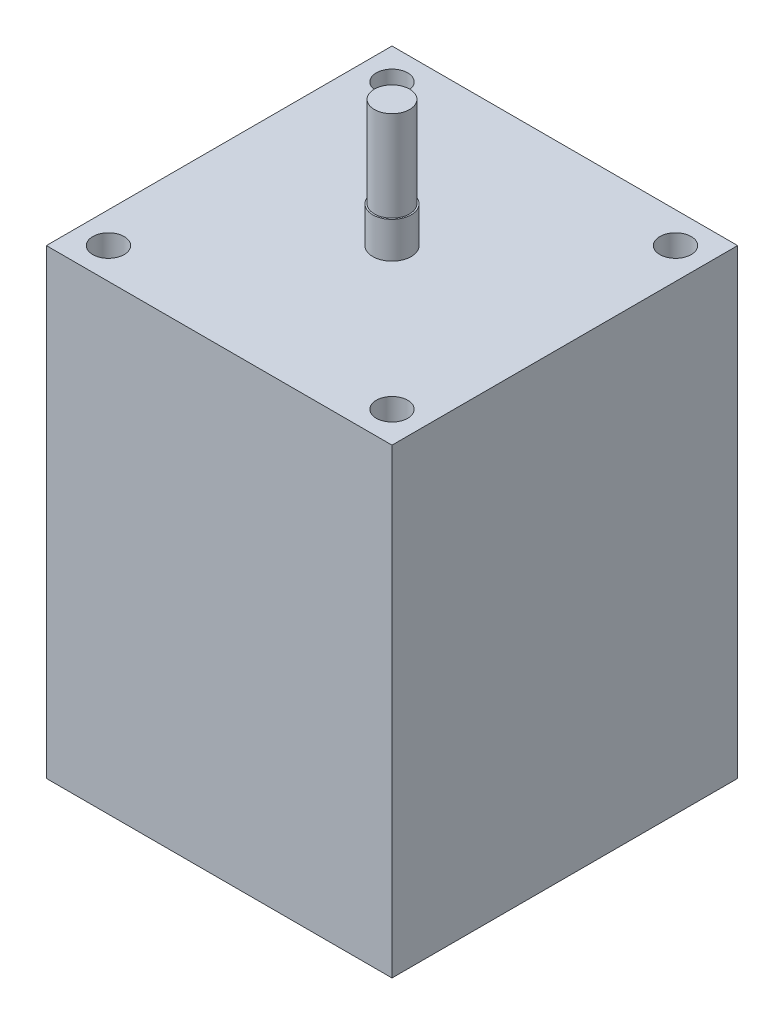
from build123d import *

# Parameters (mm, degrees)
SKETCH1_W           = 57.3
SKETCH1_H           = 57.3
SKETCH1_R           = 2.6
SKETCH1_R_2         = 3.175
BOSS_EXTRUDE1_DEPTH = 76.5
SKETCH1_4_R         = 3.175
SKETCH1_4_R_2       = 2.925
BOSS_EXTRUDE2_DEPTH = 82.5
SKETCH1_5_R         = 2.925
BOSS_EXTRUDE3_DEPTH = 97.5


with BuildPart() as part:
    # Sketch1 → Boss-Extrude1 (new body)
    with BuildSketch(Plane(origin=(0, 0, 0), x_dir=(1, 0, 0), z_dir=(0, 1, 0))):
        with Locations((28.65, -28.65)):
            Rectangle(SKETCH1_W, SKETCH1_H)
        with Locations((5.15, -52.15)):
            Circle(SKETCH1_R, mode=Mode.SUBTRACT)
        with Locations((28.65, -28.65)):
            Circle(SKETCH1_R_2, mode=Mode.SUBTRACT)
        with Locations((52.15, -52.15)):
            Circle(SKETCH1_R, mode=Mode.SUBTRACT)
        with Locations((5.15, -5.15)):
            Circle(SKETCH1_R, mode=Mode.SUBTRACT)
        with Locations((52.15, -5.15)):
            Circle(SKETCH1_R, mode=Mode.SUBTRACT)
    extrude(amount=BOSS_EXTRUDE1_DEPTH)

    # Sketch1<4> → Boss-Extrude2 (add)
    with BuildSketch(Plane(origin=(0, 0, 0), x_dir=(1, 0, 0), z_dir=(0, 1, 0))):
        with Locations((28.65, -28.65)):
            Circle(SKETCH1_4_R)
        with Locations((28.65, -28.65)):
            Circle(SKETCH1_4_R_2, mode=Mode.SUBTRACT)
    extrude(amount=BOSS_EXTRUDE2_DEPTH)

    # Sketch1<5> → Boss-Extrude3 (add)
    with BuildSketch(Plane(origin=(0, 0, 0), x_dir=(1, 0, 0), z_dir=(0, 1, 0))):
        with Locations((28.65, -28.65)):
            Circle(SKETCH1_5_R)
    extrude(amount=BOSS_EXTRUDE3_DEPTH)


solid = part.part
